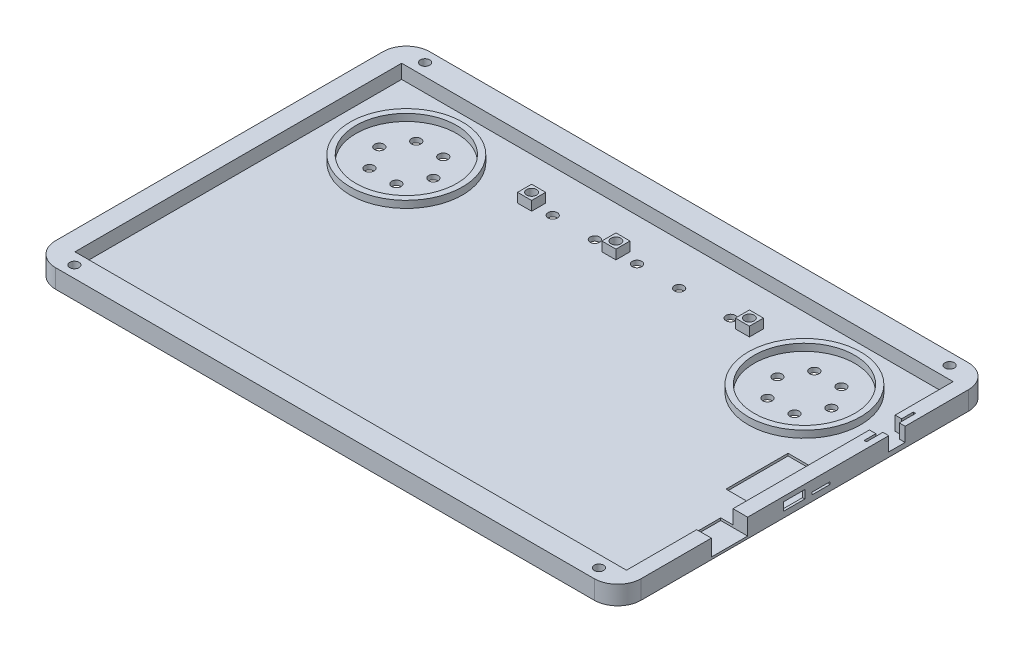
from build123d import *

# Parameters (mm, degrees)
EXTRUDE_1_DEPTH      = 8
SKETCH_2_R           = 2
CUT_EXTRUDE_1_DEPTH  = 8
SKETCH_3_W           = 235.5
SKETCH_3_H           = 139.5
CUT_EXTRUDE_2_DEPTH  = 6
SKETCH_4_R           = 2
CUT_EXTRUDE_3_DEPTH  = 6
SKETCH_6_W           = 6
SKETCH_6_H           = 6
SKETCH_6_R           = 2.1
EXTRUDE_2_DEPTH      = 4
SKETCH_7_R           = 24
SKETCH_7_R_2         = 21.5
EXTRUDE_3_DEPTH      = 3
SKETCH_8_R           = 2
CUT_EXTRUDE_4_DEPTH  = 3
SKETCH_9_W           = 11.5
SKETCH_9_H           = 15.5
CUT_EXTRUDE_5_DEPTH  = 7
CUT_EXTRUDE_6_DEPTH  = 6
SKETCH_11_W          = 20
SKETCH_11_H          = 26.5
CUT_EXTRUDE_8_DEPTH  = 1
SKETCH_13_W          = 26.5
SKETCH_13_H          = 5.5
CUT_EXTRUDE_9_DEPTH  = 5.25
SKETCH_14_W          = 9.2
SKETCH_14_H          = 3.5
SKETCH_14_W_2        = 7.8
SKETCH_14_H_2        = 1
CUT_EXTRUDE_10_DEPTH = 5.25
EXTRUDE_5_DEPTH      = 5.25
EXTRUDE_6_DEPTH      = 5.25
SKETCH_17_R          = 3
CUT_EXTRUDE_11_DEPTH = 2


with BuildPart() as part:
    # 草图1 → 凸台-拉伸1 (new body)
    with BuildSketch(Plane(origin=(0, 0, 0), x_dir=(1, 0, 0), z_dir=(0, 1, 0))):
        with BuildLine():
            Line((-106.707018927, 68.788249211), (123.292981073, 68.788249211))
            ThreePointArc((123.292981073, 68.788249211), (130.364048884, 65.859317023), (133.292981073, 58.788249211))
            Line((133.292981073, 58.788249211), (133.292981073, -80.961750789))
            ThreePointArc((133.292981073, -80.961750789), (130.364048884, -88.032818601), (123.292981073, -90.961750789))
            Line((123.292981073, -90.961750789), (-106.707018927, -90.961750789))
            ThreePointArc((-106.707018927, -90.961750789), (-113.778086739, -88.032818601), (-116.707018927, -80.961750789))
            Line((-116.707018927, -80.961750789), (-116.707018927, 58.788249211))
            ThreePointArc((-116.707018927, 58.788249211), (-113.778086739, 65.859317023), (-106.707018927, 68.788249211))
        make_face()
    extrude(amount=EXTRUDE_1_DEPTH)

    # 草图2 → 切除-拉伸1 (cut)
    with BuildSketch(Plane(origin=(0, 8, 0), x_dir=(1, 0, 0), z_dir=(0, 1, 0))):
        with Locations(Location((-103.707018927, 63.788249211, 0), (0, 0, 270))):
            Circle(SKETCH_2_R)
        with Locations(Location((-103.707018927, -85.961750789, 0), (0, 0, 270))):
            Circle(SKETCH_2_R)
        with Locations(Location((120.292981073, -85.961750789, 0), (0, 0, 270))):
            Circle(SKETCH_2_R)
        with Locations(Location((120.292981073, 63.788249211, 0), (0, 0, 270))):
            Circle(SKETCH_2_R)
    extrude(amount=-CUT_EXTRUDE_1_DEPTH, mode=Mode.SUBTRACT)

    # 草图3 → 切除-拉伸2 (cut)
    with BuildSketch(Plane(origin=(0, 8, 0), x_dir=(1, 0, 0), z_dir=(0, 1, 0))):
        with Locations((9.292981073, -11.211750789)):
            Rectangle(SKETCH_3_W, SKETCH_3_H)
    extrude(amount=-CUT_EXTRUDE_2_DEPTH, mode=Mode.SUBTRACT)

    # 草图4 → 切除-拉伸3 (cut)
    with BuildSketch(Plane(origin=(0, 2, 0), x_dir=(1, 0, 0), z_dir=(0, 1, 0))):
        with Locations(Location((-25.957018927, 40.538249211, 0), (0, 0, 270))):
            Circle(SKETCH_4_R)
        with Locations(Location((-7.957018927, 40.538249211, 0), (0, 0, 270))):
            Circle(SKETCH_4_R)
        with Locations(Location((10.042981073, 40.538249211, 0), (0, 0, 270))):
            Circle(SKETCH_4_R)
        with Locations(Location((28.042981073, 40.538249211, 0), (0, 0, 270))):
            Circle(SKETCH_4_R)
        with Locations(Location((50.042981073, 40.538249211, 0), (0, 0, 270))):
            Circle(SKETCH_4_R)
    extrude(amount=-CUT_EXTRUDE_3_DEPTH, mode=Mode.SUBTRACT)

    # 草图6 → 凸台-拉伸2 (add)
    # profile 1 of 3: a face of its own
    with BuildSketch(Plane(origin=(0, 2, 0), x_dir=(1, 0, 0), z_dir=(0, 1, 0))):
        with Locations((58.042981073, 40.538249211)):
            Rectangle(SKETCH_6_W, SKETCH_6_H)
        with Locations(Location((58.042981073, 40.538249211, 0), (0, 0, 270))):
            Circle(SKETCH_6_R, mode=Mode.SUBTRACT)
    # profile 2 of 3: a face of its own
    with BuildSketch(Plane(origin=(0, 2, 0), x_dir=(1, 0, 0), z_dir=(0, 1, 0))):
        with Locations((1.042981073, 40.538249211)):
            Rectangle(SKETCH_6_W, SKETCH_6_H)
        with Locations(Location((1.042981073, 40.538249211, 0), (0, 0, 270))):
            Circle(SKETCH_6_R, mode=Mode.SUBTRACT)
    # profile 3 of 3: a face of its own
    with BuildSketch(Plane(origin=(0, 2, 0), x_dir=(1, 0, 0), z_dir=(0, 1, 0))):
        with Locations((-34.957018927, 40.538249211)):
            Rectangle(SKETCH_6_W, SKETCH_6_H)
        with Locations(Location((-34.957018927, 40.538249211, 0), (0, 0, 270))):
            Circle(SKETCH_6_R, mode=Mode.SUBTRACT)
    extrude(amount=EXTRUDE_2_DEPTH)

    # 草图7 → 凸台-拉伸3 (add)
    # profile 1 of 2: a face of its own
    with BuildSketch(Plane(origin=(0, 2, 0), x_dir=(1, 0, 0), z_dir=(0, 1, 0))):
        with Locations(Location((-76.707018927, 28.788249211, 0), (0, 0, 270))):
            Circle(SKETCH_7_R)
        with Locations(Location((-76.707018927, 28.788249211, 0), (0, 0, 270))):
            Circle(SKETCH_7_R_2, mode=Mode.SUBTRACT)
    # profile 2 of 2: a face of its own
    with BuildSketch(Plane(origin=(0, 2, 0), x_dir=(1, 0, 0), z_dir=(0, 1, 0))):
        with Locations(Location((93.292981073, 28.788249211, 0), (0, 0, 270))):
            Circle(SKETCH_7_R)
        with Locations(Location((93.292981073, 28.788249211, 0), (0, 0, 270))):
            Circle(SKETCH_7_R_2, mode=Mode.SUBTRACT)
    extrude(amount=EXTRUDE_3_DEPTH)

    # 草图8 → 切除-拉伸4 (cut)
    with BuildSketch(Plane(origin=(0, 2, 0), x_dir=(1, 0, 0), z_dir=(0, 1, 0))):
        with Locations(Location((-82.480521619, 38.788249211, 0), (0, 0, 270))):
            Circle(SKETCH_8_R)
        with Locations(Location((-70.933516236, 38.788249211, 0), (0, 0, 270))):
            Circle(SKETCH_8_R)
        with Locations(Location((-65.160013544, 28.788249211, 0), (0, 0, 270))):
            Circle(SKETCH_8_R)
        with Locations(Location((-70.933516236, 18.788249211, 0), (0, 0, 270))):
            Circle(SKETCH_8_R)
        with Locations(Location((-82.480521619, 18.788249211, 0), (0, 0, 270))):
            Circle(SKETCH_8_R)
        with Locations(Location((-88.254024311, 28.788249211, 0), (0, 0, 270))):
            Circle(SKETCH_8_R)
        with Locations(Location((87.519478381, 38.788249211, 0), (0, 0, 270))):
            Circle(SKETCH_8_R)
        with Locations(Location((99.066483764, 38.788249211, 0), (0, 0, 270))):
            Circle(SKETCH_8_R)
        with Locations(Location((104.839986456, 28.788249211, 0), (0, 0, 270))):
            Circle(SKETCH_8_R)
        with Locations(Location((99.066483764, 18.788249211, 0), (0, 0, 270))):
            Circle(SKETCH_8_R)
        with Locations(Location((87.519478381, 18.788249211, 0), (0, 0, 270))):
            Circle(SKETCH_8_R)
        with Locations(Location((81.745975689, 28.788249211, 0), (0, 0, 270))):
            Circle(SKETCH_8_R)
    extrude(amount=-CUT_EXTRUDE_4_DEPTH, mode=Mode.SUBTRACT)

    # 草图9 → 切除-拉伸5 (cut)
    with BuildSketch(Plane(origin=(0, 8, 0), x_dir=(1, 0, 0), z_dir=(0, 1, 0))):
        with Locations((127.542981073, -43.211750789)):
            Rectangle(SKETCH_9_W, SKETCH_9_H)
    extrude(amount=-CUT_EXTRUDE_5_DEPTH, mode=Mode.SUBTRACT)

    # 草图10 → 切除-拉伸6 (cut)
    with BuildSketch(Plane(origin=(0, 8, 0), x_dir=(1, 0, 0), z_dir=(0, 1, 0))):
        Polygon((127.042981073, 33.788249211), (127.042981073, 22.788249211), (129.792981073, 22.788249211), (129.792981073, 17.788249211), (130.792981073, 17.788249211), (130.792981073, 24.788249211), (133.292981073, 24.788249211), (133.292981073, 31.788249211), (130.792981073, 31.788249211), (130.792981073, 38.788249211), (129.792981073, 38.788249211), (129.792981073, 33.788249211), align=None)
    extrude(amount=-CUT_EXTRUDE_6_DEPTH, mode=Mode.SUBTRACT)

    # 草图11 → 切除-拉伸8 (cut)
    with BuildSketch(Plane(origin=(0, 2, 0), x_dir=(1, 0, 0), z_dir=(0, 1, 0))):
        with Locations((122.292981073, -10.461750789)):
            Rectangle(SKETCH_11_W, SKETCH_11_H)
    extrude(amount=-CUT_EXTRUDE_8_DEPTH, mode=Mode.SUBTRACT)

    # 草图13 → 切除-拉伸9 (cut)
    with BuildSketch(Plane.ZY.offset(-127.042981073)):
        with Locations((10.461750789, 4.75)):
            Rectangle(SKETCH_13_W, SKETCH_13_H)
    extrude(amount=-CUT_EXTRUDE_9_DEPTH, mode=Mode.SUBTRACT)

    # 草图14 → 切除-拉伸10 (cut)
    with BuildSketch(Plane.ZY.offset(-132.292981073)):
        with Locations((15.611750789, 4.25)):
            Rectangle(SKETCH_14_W, SKETCH_14_H)
        with Locations((4.111750789, 3)):
            Rectangle(SKETCH_14_W_2, SKETCH_14_H_2)
    extrude(amount=-CUT_EXTRUDE_10_DEPTH, mode=Mode.SUBTRACT)

    # 草图15 → 凸台-拉伸5 (add)
    with BuildSketch(Plane.ZY.offset(-127.042981073)):
        Polygon((-2.788249211, 7.5), (-0.288249211, 7.5), (-2.788249211, 5), align=None)
    extrude(amount=-EXTRUDE_5_DEPTH)

    # 草图16 → 凸台-拉伸6 (add)
    with BuildSketch(Plane.ZY.offset(-127.042981073)):
        Polygon((23.711750789, 7.5), (23.711750789, 5.5), (21.711750789, 7.5), align=None)
    extrude(amount=-EXTRUDE_6_DEPTH)

    # 草图17 → 切除-拉伸11 (cut)
    with BuildSketch(Plane.XZ):
        with Locations(Location((-103.707018927, 85.961750789, 0), (0, 0, 270))):
            Circle(SKETCH_17_R)
        with Locations(Location((120.292981073, 85.961750789, 0), (0, 0, 270))):
            Circle(SKETCH_17_R)
        with Locations(Location((120.292981073, -63.788249211, 0), (0, 0, 270))):
            Circle(SKETCH_17_R)
        with Locations(Location((-103.707018927, -63.788249211, 0), (0, 0, 270))):
            Circle(SKETCH_17_R)
    extrude(amount=-CUT_EXTRUDE_11_DEPTH, mode=Mode.SUBTRACT)


solid = part.part
